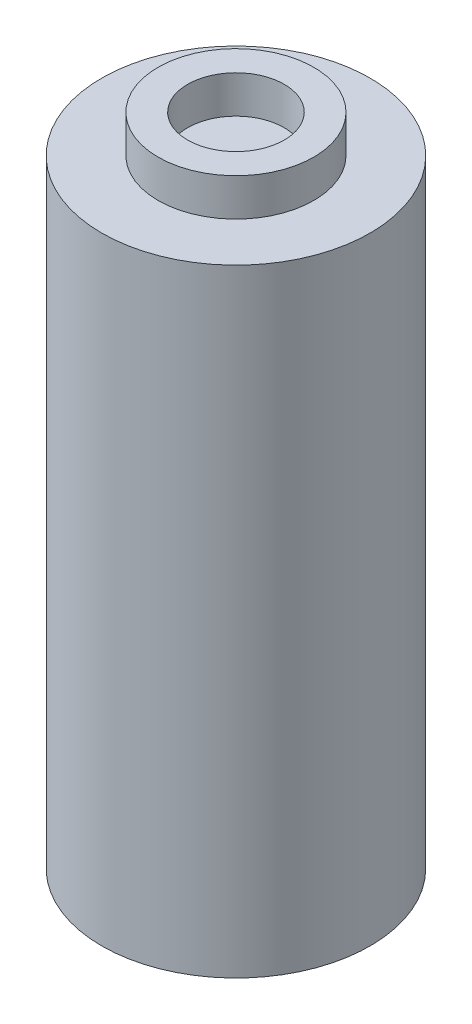
from build123d import *

# Parameters (mm, degrees)
ESQUISSE1_R        = 5
BOSS_EXTRU_1_DEPTH = 23
ESQUISSE2_R        = 2.9
ESQUISSE2_R_2      = 1.8
BOSS_EXTRU_2_DEPTH = 1.4


with BuildPart() as part:
    # Esquisse1 → Boss.-Extru.1 (new body)
    with BuildSketch(Plane(origin=(0, 0, 0), x_dir=(1, 0, 0), z_dir=(0, 1, 0))):
        with Locations(Location((0, 0, 0), (0, 0, 270))):
            Circle(ESQUISSE1_R)
    extrude(amount=BOSS_EXTRU_1_DEPTH)

    # Esquisse2 → Boss.-Extru.2 (add)
    with BuildSketch(Plane(origin=(0, 23, 0), x_dir=(1, 0, 0), z_dir=(0, 1, 0))):
        with Locations(Location((0, 0, 0), (0, 0, 270))):
            Circle(ESQUISSE2_R)
        with Locations(Location((0, 0, 0), (0, 0, 270))):
            Circle(ESQUISSE2_R_2, mode=Mode.SUBTRACT)
    extrude(amount=BOSS_EXTRU_2_DEPTH)


solid = part.part
